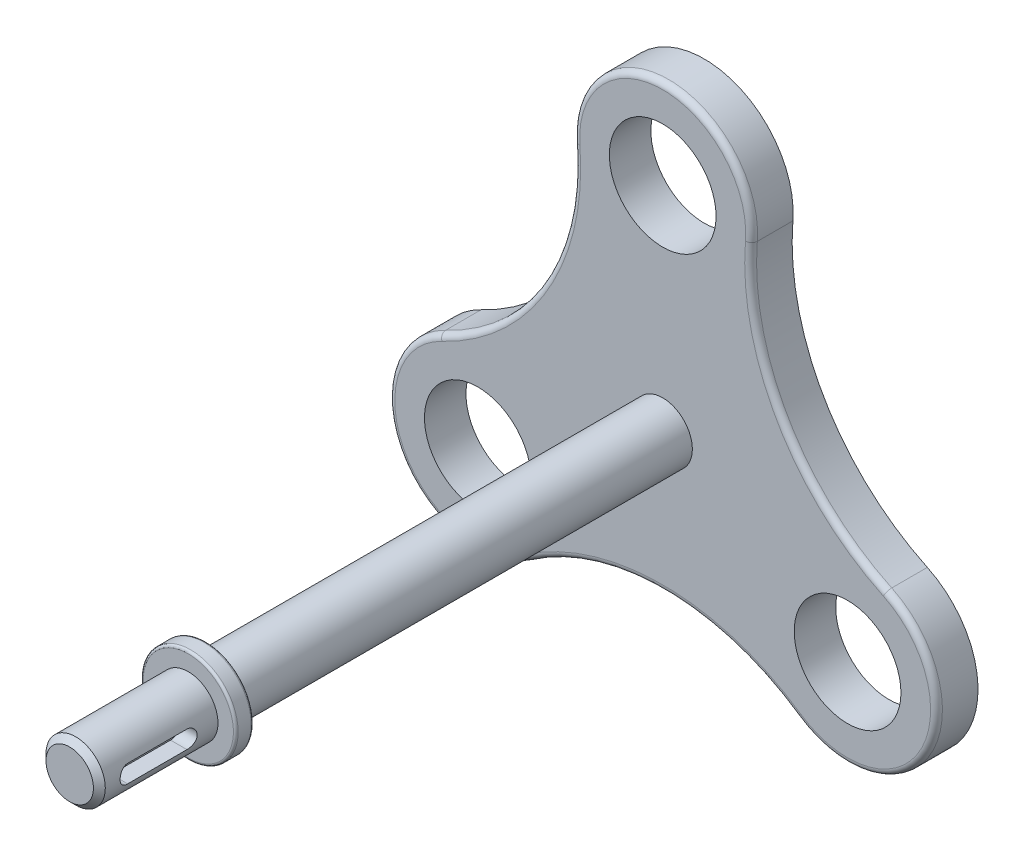
from build123d import *

# Parameters (mm, degrees)
SKETCH1_R           = 4.5
BOSS_EXTRUDE1_DEPTH = 3.5
CUT_EXTRUDE1_DEPTH  = 1.5
FILLET1_R           = 0.5
FILLET2_R           = 0.2
CHAMFER1_SIZE       = 0.5


with BuildPart() as part:
    # Sketch1 → Boss-Extrude1 (new body)
    with BuildSketch(Plane.XY):
        with BuildLine():
            ThreePointArc((7.476559852, 17.407502934), (0, 25.5), (-7.476559852, 17.407502934))
            ThreePointArc((-7.476559852, 17.407502934), (-10.093544717, 5.827510759), (-18.813619684, -2.228860702))
            ThreePointArc((-18.813619684, -2.228860702), (-22.083647797, -12.75), (-11.337059831, -15.178642232))
            ThreePointArc((-11.337059831, -15.178642232), (0, -11.655021518), (11.337059831, -15.178642232))
            ThreePointArc((11.337059831, -15.178642232), (22.083647797, -12.75), (18.813619684, -2.228860702))
            ThreePointArc((18.813619684, -2.228860702), (10.093544717, 5.827510759), (7.476559852, 17.407502934))
        make_face()
        with Locations((0, 18)):
            Circle(SKETCH1_R, mode=Mode.SUBTRACT)
        with Locations((15.588457268, -9)):
            Circle(SKETCH1_R, mode=Mode.SUBTRACT)
        with Locations((-15.588457268, -9)):
            Circle(SKETCH1_R, mode=Mode.SUBTRACT)
    extrude(amount=BOSS_EXTRUDE1_DEPTH)

    # Sketch2 → Revolve4 (revolve)
    with BuildSketch(Plane(origin=(0, 0, 0), x_dir=(0, 0, -1), z_dir=(1, 0, 0)), mode=Mode.PRIVATE) as revolve4_sk:
        Polygon((-53.5, 2.5), (-43.5, 2.5), (-43.5, 4), (-42, 4), (-42, 2.5), (-3.5, 2.5), (-3.5, 0), (-53.5, 0), align=None)
    revolve(revolve4_sk.sketch.rotate(Axis((0, 0, 49.596889026), (0, 0, -1)), 90), axis=Axis((0, 0, 49.596889026), (0, 0, -1)))

    # Sketch6 → Cut-Extrude1 (cut)
    with BuildSketch(Plane(origin=(2.5, 0, 0), x_dir=(0, 0, -1), z_dir=(1, 0, 0))):
        with BuildLine():
            Line((-51, 0.75), (-46, 0.75))
            ThreePointArc((-46, 0.75), (-45.25, 0), (-46, -0.75))
            Line((-46, -0.75), (-51, -0.75))
            ThreePointArc((-51, -0.75), (-51.75, 0), (-51, 0.75))
        make_face()
    extrude(amount=-CUT_EXTRUDE1_DEPTH, mode=Mode.SUBTRACT)

    # Fillet1
    fillet1_edges = [part.edges().sort_by_distance(p)[0] for p in [
        (-10.093544717, 5.827510759, 3.5),
        (-22.083647797, -12.75, 3.5),
        (0, -11.655021518, 3.5),
        (22.083647797, -12.75, 3.5),
        (10.093544717, 5.827510759, 3.5),
        (0, 25.5, 3.5),
    ]]
    fillet(fillet1_edges, radius=FILLET1_R)

    # Fillet2
    fillet2_edges = [part.edges().sort_by_distance(p)[0] for p in [
        (-4, 0, 42),
        (-4, 0, 43.5),
    ]]
    fillet(fillet2_edges, radius=FILLET2_R)

    # Chamfer1
    chamfer1_edges = [part.edges().sort_by_distance(p)[0] for p in [
        (-2.5, 0, 53.5),
    ]]
    chamfer(chamfer1_edges, length=CHAMFER1_SIZE)


solid = part.part
